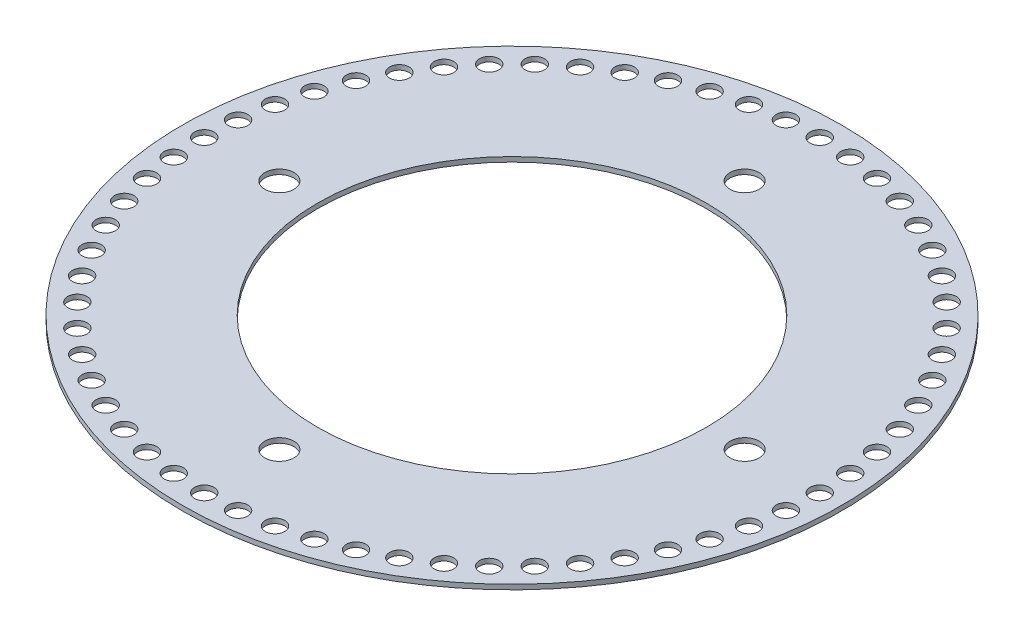
from build123d import *

# Parameters (mm, degrees)
SKETCH1_R           = 34
SKETCH1_R_2         = 20.05
BOSS_EXTRUDE1_DEPTH = 0.5
SKETCH2_R           = 1
CUT_EXTRUDE1_DEPTH  = 49.085860708
SKETCH3_R           = 1.5
CUT_EXTRUDE2_DEPTH  = 10


with BuildPart() as part:
    # Sketch1 → Boss-Extrude1 (new body)
    with BuildSketch(Plane(origin=(0, 0, 0), x_dir=(1, 0, 0), z_dir=(0, 1, 0))):
        with Locations(Location((0, 0, 0), (0, 0, 270))):
            Circle(SKETCH1_R)
        with Locations(Location((0, 0, 0), (0, 0, 270))):
            Circle(SKETCH1_R_2, mode=Mode.SUBTRACT)
    extrude(amount=BOSS_EXTRUDE1_DEPTH)

    # Sketch2 → Cut-Extrude1 (cut, through all)
    with BuildSketch(Plane(origin=(0, 0.5, 0), x_dir=(1, 0, 0), z_dir=(0, 1, 0))):
        with Locations(Location((0, 31.75, 0), (0, 0, 270))):
            Circle(SKETCH2_R)
        with Locations(Location((3.318778709, 31.576070178, 0), (0, 0, 270))):
            Circle(SKETCH2_R)
        with Locations(Location((6.601196183, 31.056186323, 0), (0, 0, 270))):
            Circle(SKETCH2_R)
        with Locations(Location((9.811289571, 30.196044392, 0), (0, 0, 270))):
            Circle(SKETCH2_R)
        with Locations(Location((12.913888418, 29.00506828, 0), (0, 0, 270))):
            Circle(SKETCH2_R)
        with Locations(Location((15.875, 27.49630657, 0), (0, 0, 270))):
            Circle(SKETCH2_R)
        with Locations(Location((18.66218176, 25.686289571, 0), (0, 0, 270))):
            Circle(SKETCH2_R)
        with Locations(Location((21.244896752, 23.594848209, 0), (0, 0, 270))):
            Circle(SKETCH2_R)
        with Locations(Location((23.594848209, 21.244896752, 0), (0, 0, 270))):
            Circle(SKETCH2_R)
        with Locations(Location((25.686289571, 18.66218176, 0), (0, 0, 270))):
            Circle(SKETCH2_R)
        with Locations(Location((27.49630657, 15.875, 0), (0, 0, 270))):
            Circle(SKETCH2_R)
        with Locations(Location((29.00506828, 12.913888418, 0), (0, 0, 270))):
            Circle(SKETCH2_R)
        with Locations(Location((30.196044392, 9.811289571, 0), (0, 0, 270))):
            Circle(SKETCH2_R)
        with Locations(Location((31.056186323, 6.601196183, 0), (0, 0, 270))):
            Circle(SKETCH2_R)
        with Locations(Location((31.576070178, 3.318778709, 0), (0, 0, 270))):
            Circle(SKETCH2_R)
        with Locations(Location((31.75, 0, 0), (0, 0, 270))):
            Circle(SKETCH2_R)
        with Locations(Location((31.576070178, -3.318778709, 0), (0, 0, 270))):
            Circle(SKETCH2_R)
        with Locations(Location((31.056186323, -6.601196183, 0), (0, 0, 270))):
            Circle(SKETCH2_R)
        with Locations(Location((30.196044392, -9.811289571, 0), (0, 0, 270))):
            Circle(SKETCH2_R)
        with Locations(Location((29.00506828, -12.913888418, 0), (0, 0, 270))):
            Circle(SKETCH2_R)
        with Locations(Location((27.49630657, -15.875, 0), (0, 0, 270))):
            Circle(SKETCH2_R)
        with Locations(Location((25.686289571, -18.66218176, 0), (0, 0, 270))):
            Circle(SKETCH2_R)
        with Locations(Location((23.594848209, -21.244896752, 0), (0, 0, 270))):
            Circle(SKETCH2_R)
        with Locations(Location((21.244896752, -23.594848209, 0), (0, 0, 270))):
            Circle(SKETCH2_R)
        with Locations(Location((18.66218176, -25.686289571, 0), (0, 0, 270))):
            Circle(SKETCH2_R)
        with Locations(Location((15.875, -27.49630657, 0), (0, 0, 270))):
            Circle(SKETCH2_R)
        with Locations(Location((12.913888418, -29.00506828, 0), (0, 0, 270))):
            Circle(SKETCH2_R)
        with Locations(Location((9.811289571, -30.196044392, 0), (0, 0, 270))):
            Circle(SKETCH2_R)
        with Locations(Location((6.601196183, -31.056186323, 0), (0, 0, 270))):
            Circle(SKETCH2_R)
        with Locations(Location((3.318778709, -31.576070178, 0), (0, 0, 270))):
            Circle(SKETCH2_R)
        with Locations(Location((0, -31.75, 0), (0, 0, 270))):
            Circle(SKETCH2_R)
        with Locations(Location((-3.318778709, -31.576070178, 0), (0, 0, 270))):
            Circle(SKETCH2_R)
        with Locations(Location((-6.601196183, -31.056186323, 0), (0, 0, 270))):
            Circle(SKETCH2_R)
        with Locations(Location((-9.811289571, -30.196044392, 0), (0, 0, 270))):
            Circle(SKETCH2_R)
        with Locations(Location((-12.913888418, -29.00506828, 0), (0, 0, 270))):
            Circle(SKETCH2_R)
        with Locations(Location((-15.875, -27.49630657, 0), (0, 0, 270))):
            Circle(SKETCH2_R)
        with Locations(Location((-18.66218176, -25.686289571, 0), (0, 0, 270))):
            Circle(SKETCH2_R)
        with Locations(Location((-21.244896752, -23.594848209, 0), (0, 0, 270))):
            Circle(SKETCH2_R)
        with Locations(Location((-23.594848209, -21.244896752, 0), (0, 0, 270))):
            Circle(SKETCH2_R)
        with Locations(Location((-25.686289571, -18.66218176, 0), (0, 0, 270))):
            Circle(SKETCH2_R)
        with Locations(Location((-27.49630657, -15.875, 0), (0, 0, 270))):
            Circle(SKETCH2_R)
        with Locations(Location((-29.00506828, -12.913888418, 0), (0, 0, 270))):
            Circle(SKETCH2_R)
        with Locations(Location((-30.196044392, -9.811289571, 0), (0, 0, 270))):
            Circle(SKETCH2_R)
        with Locations(Location((-31.056186323, -6.601196183, 0), (0, 0, 270))):
            Circle(SKETCH2_R)
        with Locations(Location((-31.576070178, -3.318778709, 0), (0, 0, 270))):
            Circle(SKETCH2_R)
        with Locations(Location((-31.75, 0, 0), (0, 0, 270))):
            Circle(SKETCH2_R)
        with Locations(Location((-31.576070178, 3.318778709, 0), (0, 0, 270))):
            Circle(SKETCH2_R)
        with Locations(Location((-31.056186323, 6.601196183, 0), (0, 0, 270))):
            Circle(SKETCH2_R)
        with Locations(Location((-30.196044392, 9.811289571, 0), (0, 0, 270))):
            Circle(SKETCH2_R)
        with Locations(Location((-29.00506828, 12.913888418, 0), (0, 0, 270))):
            Circle(SKETCH2_R)
        with Locations(Location((-27.49630657, 15.875, 0), (0, 0, 270))):
            Circle(SKETCH2_R)
        with Locations(Location((-25.686289571, 18.66218176, 0), (0, 0, 270))):
            Circle(SKETCH2_R)
        with Locations(Location((-23.594848209, 21.244896752, 0), (0, 0, 270))):
            Circle(SKETCH2_R)
        with Locations(Location((-21.244896752, 23.594848209, 0), (0, 0, 270))):
            Circle(SKETCH2_R)
        with Locations(Location((-18.66218176, 25.686289571, 0), (0, 0, 270))):
            Circle(SKETCH2_R)
        with Locations(Location((-15.875, 27.49630657, 0), (0, 0, 270))):
            Circle(SKETCH2_R)
        with Locations(Location((-12.913888418, 29.00506828, 0), (0, 0, 270))):
            Circle(SKETCH2_R)
        with Locations(Location((-9.811289571, 30.196044392, 0), (0, 0, 270))):
            Circle(SKETCH2_R)
        with Locations(Location((-6.601196183, 31.056186323, 0), (0, 0, 270))):
            Circle(SKETCH2_R)
        with Locations(Location((-3.318778709, 31.576070178, 0), (0, 0, 270))):
            Circle(SKETCH2_R)
    extrude(amount=-CUT_EXTRUDE1_DEPTH, mode=Mode.SUBTRACT)

    # Sketch3 → Cut-Extrude2 (cut)
    with BuildSketch(Plane(origin=(0, 0.5, 0), x_dir=(1, 0, 0), z_dir=(0, 1, 0))):
        with Locations(Location((0, 24, 0), (0, 0, 270))):
            Circle(SKETCH3_R)
        with Locations(Location((24, 0, 0), (0, 0, 270))):
            Circle(SKETCH3_R)
        with Locations(Location((0, -24, 0), (0, 0, 270))):
            Circle(SKETCH3_R)
        with Locations(Location((-24, 0, 0), (0, 0, 270))):
            Circle(SKETCH3_R)
    extrude(amount=-CUT_EXTRUDE2_DEPTH, mode=Mode.SUBTRACT)


solid = part.part
